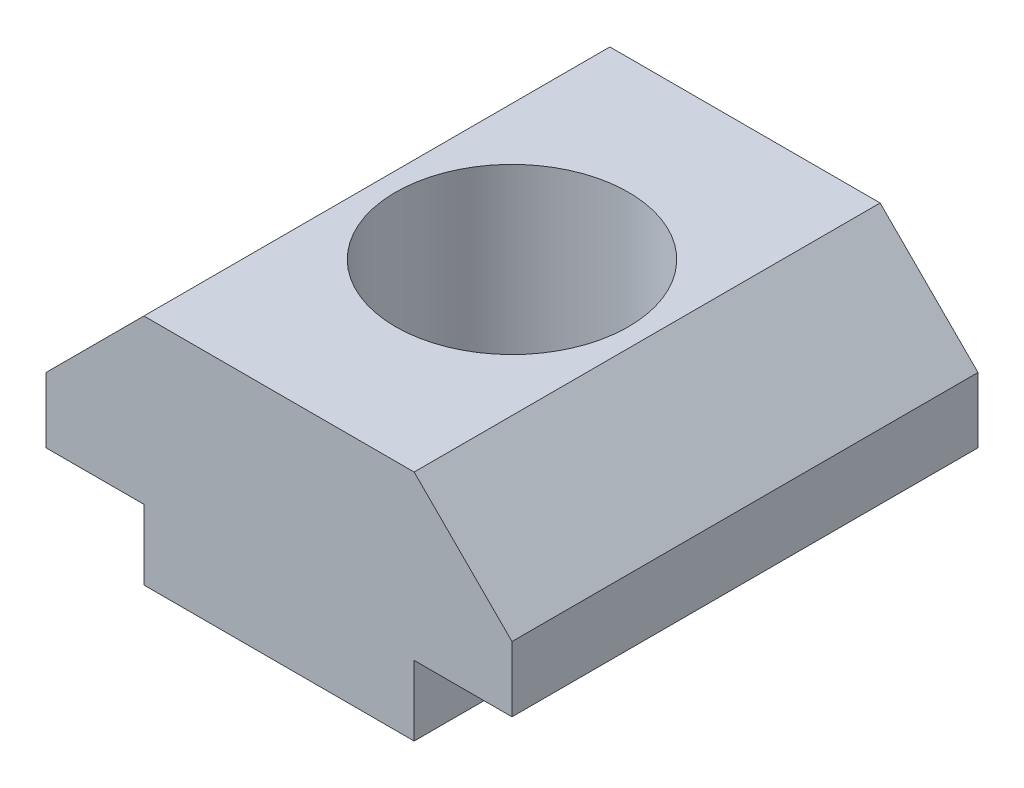
from build123d import *

# Parameters (mm, degrees)
EXTRUDE_1_DEPTH     = 10
SKETCH_4_R          = 2.5
CUT_EXTRUDE_1_DEPTH = 13.247448714


with BuildPart() as part:
    # 草图1 → 凸台-拉伸1 (new body)
    with BuildSketch(Plane.XY):
        Polygon((-2.9, 0), (2.9, 0), (2.9, 1.5), (5, 1.5), (5, 2.9), (2.9, 5), (-2.9, 5), (-5, 2.9), (-5, 1.5), (-2.9, 1.5), align=None)
    extrude(amount=-EXTRUDE_1_DEPTH)

    # 草图4 → 切除-拉伸1 (cut, through all)
    with BuildSketch(Plane(origin=(0, 5, 0), x_dir=(1, 0, 0), z_dir=(0, 1, 0))):
        with Locations(Location((0, 5, 0), (0, 0, 270))):
            Circle(SKETCH_4_R)
    extrude(amount=-CUT_EXTRUDE_1_DEPTH, mode=Mode.SUBTRACT)


solid = part.part
